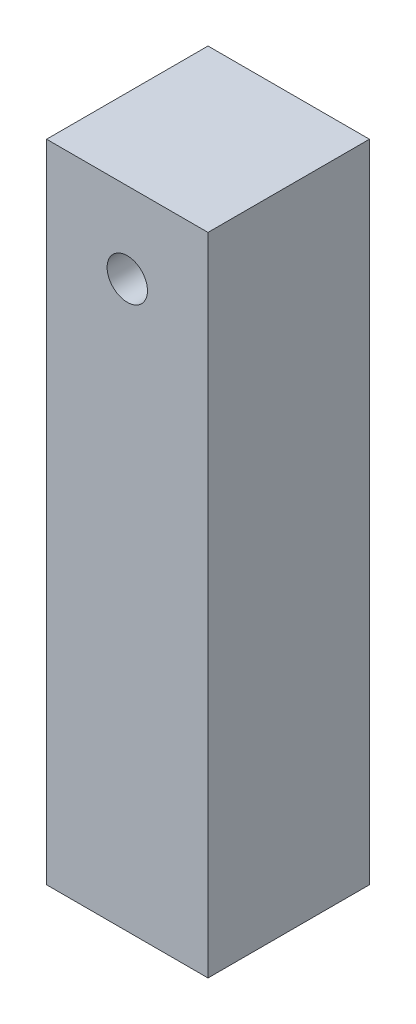
from build123d import *

# Parameters (mm, degrees)
SKETCH1_W           = 25.4
SKETCH1_H           = 25.4
BOSS_EXTRUDE1_DEPTH = 101.6
SKETCH2_R           = 3.175
CUT_EXTRUDE1_DEPTH  = 101.6


with BuildPart() as part:
    # Sketch1 → Boss-Extrude1 (new body)
    with BuildSketch(Plane(origin=(0, 0, 0), x_dir=(1, 0, 0), z_dir=(0, 1, 0))):
        with Locations((-1.832989691, -0.78556701)):
            Rectangle(SKETCH1_W, SKETCH1_H)
    extrude(amount=BOSS_EXTRUDE1_DEPTH)

    # Sketch2 → Cut-Extrude1 (cut)
    with BuildSketch(Plane.XY.offset(13.48556701)):
        with Locations((-1.832989691, 88.9)):
            Circle(SKETCH2_R)
    extrude(amount=-CUT_EXTRUDE1_DEPTH, mode=Mode.SUBTRACT)


solid = part.part
